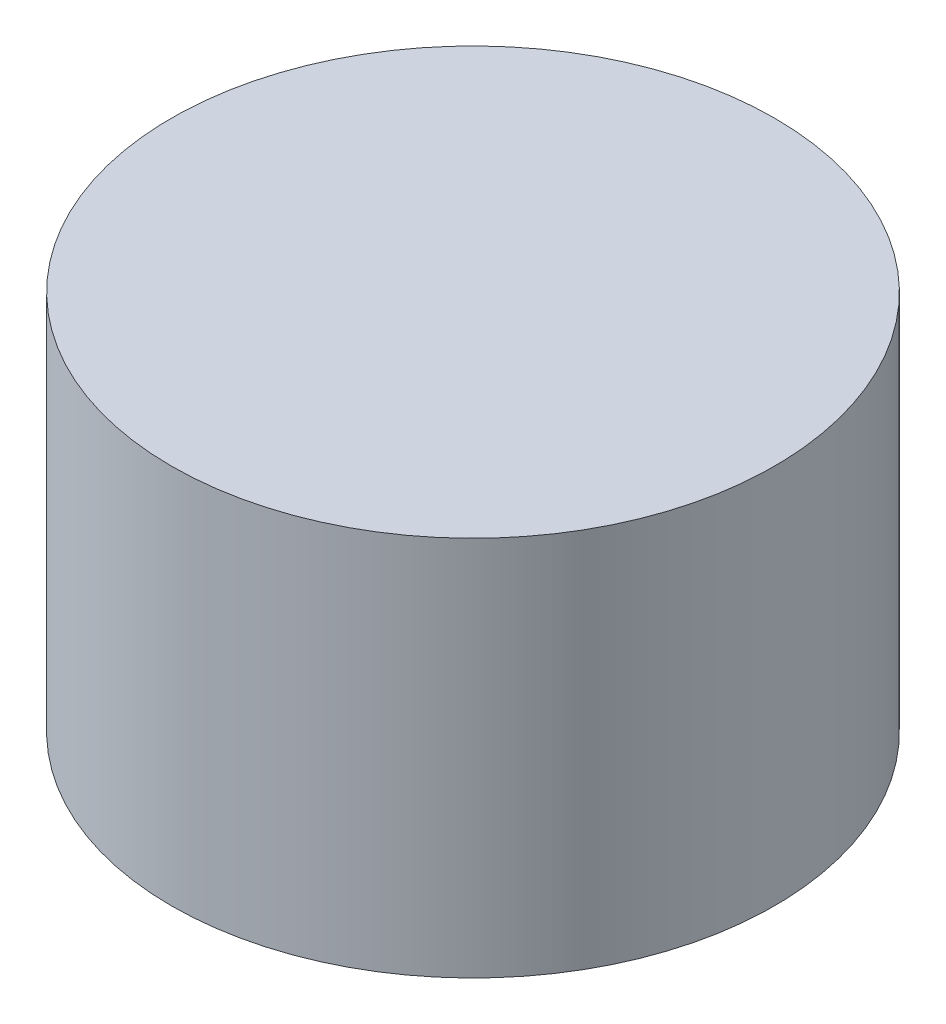
from build123d import *

# Parameters (mm, degrees)
SKETCH1_R           = 4.75
BOSS_EXTRUDE1_DEPTH = 6


with BuildPart() as part:
    # Sketch1 → Boss-Extrude1 (new body)
    with BuildSketch(Plane(origin=(0, 0, 0), x_dir=(1, 0, 0), z_dir=(0, 1, 0))):
        with Locations(Location((0, 0, 0), (0, 0, 270))):
            Circle(SKETCH1_R)
    extrude(amount=BOSS_EXTRUDE1_DEPTH)


solid = part.part
